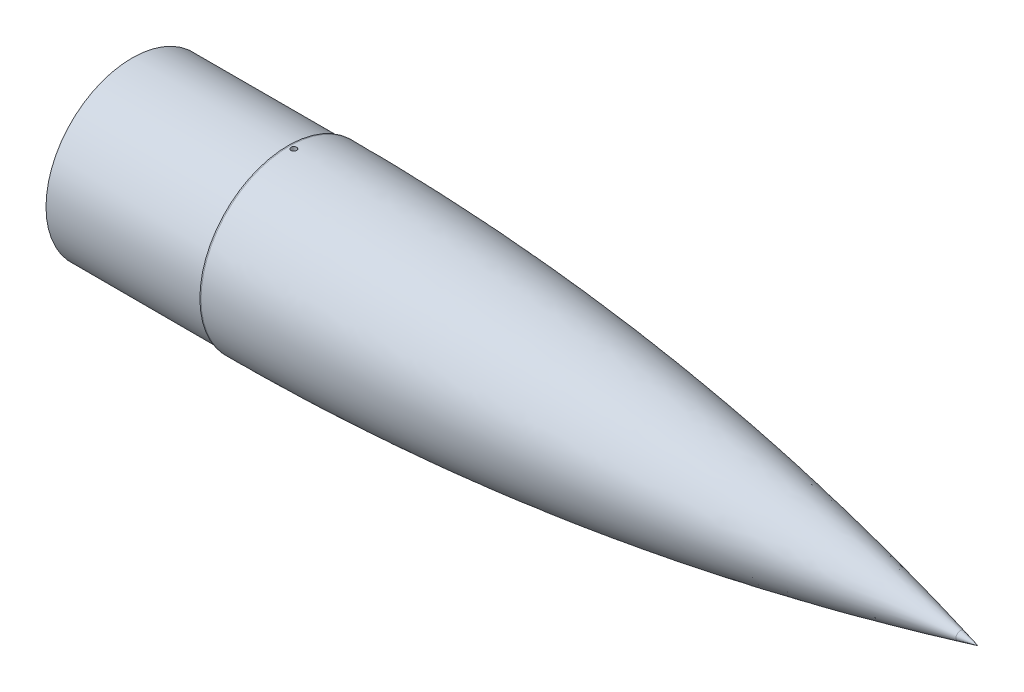
from build123d import *

# Parameters (mm, degrees)
ESQUISSE2_R                  = 76
ESQUISSE2_R_2                = 74
BOSS_EXTRU_1_DEPTH           = 138
ENL_V_MAT_EXTRU_1_DEPTH      = 649.747842898
ENL_V_MAT_EXTRU_1_DEPTH_BACK = 649.747842898
ESQUISSE3_R                  = 2.5


with BuildPart() as part:
    # Esquisse1 → Révolution3 (revolve)
    with BuildSketch(Plane.XY, mode=Mode.PRIVATE) as r_volution3_sk:
        with BuildLine():
            Line((-501.300996115, 74), (-500.300996115, 74))
            add(Edge.make_bspline(
                [(-500.300996115, 74), (-205.033047174, 74), (91.764741907, 0)],
                knots=[0, 0, 0, 1, 1, 1], degree=2))
            Line((91.764741907, 0), (108.299003885, 0))
            Line((108.299003885, 0), (92.73242949, 3.881182905))
            add(Edge.make_bspline(
                [(-500.300996115, 78), (-475.642620813, 78), (-426.347775001, 77.227857011), (-327.655384553, 72.595044211), (-228.880403388, 63.329565703), (-130.008955254, 49.431853826), (-68.17659714, 38.81586159), (-18.687478169, 29.165105527), (18.439887897, 21.348330719), (49.391507437, 14.351271458), (74.152443409, 8.465691784), (86.545764546, 5.42369172), (92.73242949, 3.881182905)],
                knots=[0, 0, 0, 0, 0.125, 0.25, 0.5, 0.625, 0.75, 0.8125, 0.875, 0.9375, 0.96875, 1, 1, 1, 1], degree=3))
            Line((-500.300996115, 78), (-501.300996115, 78))
            Line((-501.300996115, 78), (-501.300996115, 74))
        make_face()
    revolve(r_volution3_sk.sketch.rotate(Axis((-218.288054544, 0, 0), (1, 0, 0)), 90), axis=Axis((-218.288054544, 0, 0), (1, 0, 0)))

    # Esquisse2 → Boss.-Extru.1 (add)
    with BuildSketch(Plane.ZY.offset(501.300996115)):
        with Locations(Location((0, 0, 0), (0, 0, 180))):
            Circle(ESQUISSE2_R)
        Circle(ESQUISSE2_R_2, mode=Mode.SUBTRACT)
    extrude(amount=BOSS_EXTRU_1_DEPTH)

    # Esquisse3 → Enlèv. mat.-Extru.1 (cut, two sides: drawn at the far end of the back side and taken through both)
    with BuildSketch(Plane(origin=(0, 0, 0), x_dir=(1, 0, 0), z_dir=(0, 1, 0)).offset(-ENL_V_MAT_EXTRU_1_DEPTH_BACK)):
        with Locations(Location((-496.300996115, 0, 0), (0, 0, 270))):
            Circle(ESQUISSE3_R)
    extrude(amount=ENL_V_MAT_EXTRU_1_DEPTH + ENL_V_MAT_EXTRU_1_DEPTH_BACK, mode=Mode.SUBTRACT)


solid = part.part
